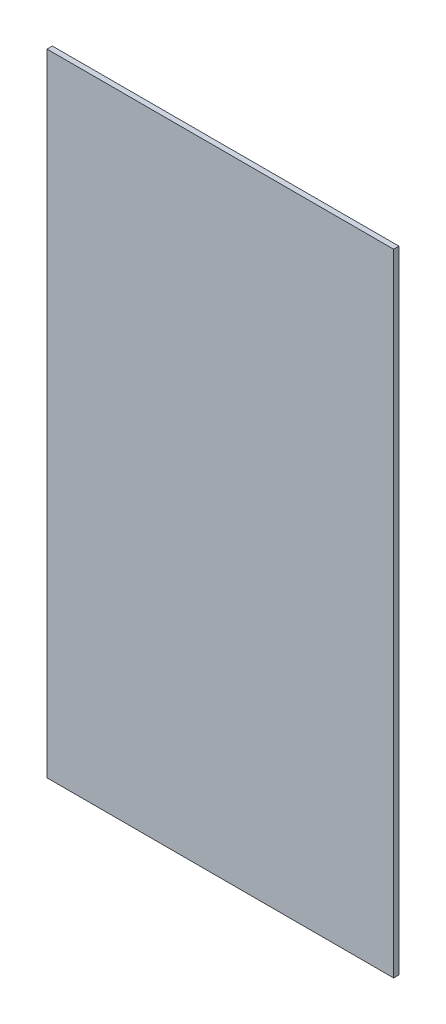
from build123d import *

# Parameters (mm, degrees)
SKICA1_W                = 195
SKICA1_H                = 355
P_IDAT_VYSUNUT_M1_DEPTH = 3


with BuildPart() as part:
    # Skica1 → Přidat vysunutím1 (new body)
    with BuildSketch(Plane.XY):
        Rectangle(SKICA1_W, SKICA1_H)
    extrude(amount=P_IDAT_VYSUNUT_M1_DEPTH)


solid = part.part
